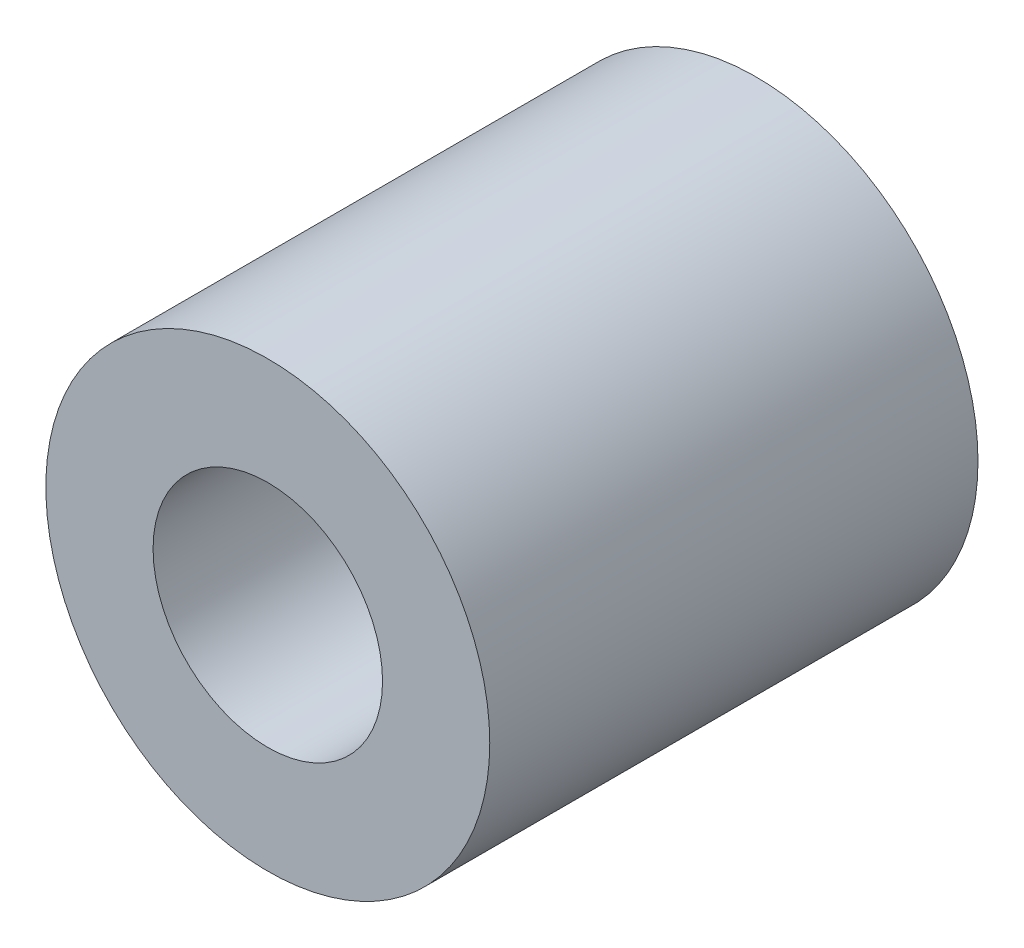
from build123d import *

# Parameters (mm, degrees)
SKETCH1_R           = 18.185
SKETCH1_R_2         = 9.4
BOSS_EXTRUDE1_DEPTH = 40


with BuildPart() as part:
    # Sketch1 → Boss-Extrude1 (new body)
    with BuildSketch(Plane.XY):
        Circle(SKETCH1_R)
        Circle(SKETCH1_R_2, mode=Mode.SUBTRACT)
    extrude(amount=BOSS_EXTRUDE1_DEPTH)


solid = part.part
